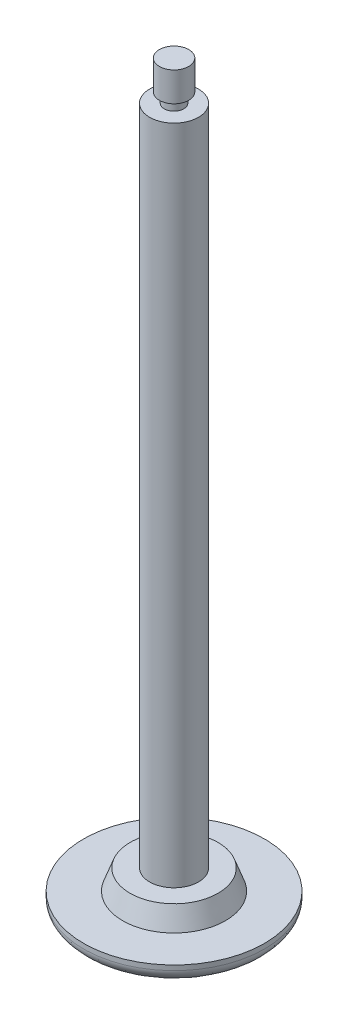
from build123d import *


with BuildPart() as part:
    # Sketch1 → Revolve1 (revolve)
    with BuildSketch(Plane.XY):
        with BuildLine():
            Line((18.5, 7), (18.5, 8))
            Line((18.5, 8), (10.5, 8))
            Line((10.5, 8), (9, 12.121216129))
            Line((9, 12.121216129), (5, 12.121216129))
            Line((5, 12.121216129), (5, 147.5))
            Line((5, 147.5), (2, 147.5))
            Line((2, 147.5), (2, 149.5))
            Line((2, 149.5), (3, 149.5))
            Line((3, 149.5), (3, 155.5))
            Line((3, 155.5), (0, 155.5))
            Line((0, 155.5), (0, 1))
            add(Edge.make_bspline(
                [(0, 1), (18.5, 1), (18.5, 7)],
                knots=[4.71238898, 4.71238898, 4.71238898, 6.283185307, 6.283185307, 6.283185307], degree=2, weights=[1, 0.707106781, 1]))
        make_face()
    revolve(axis=Axis((0, 0, 0), (0, 1, 0)))


solid = part.part
